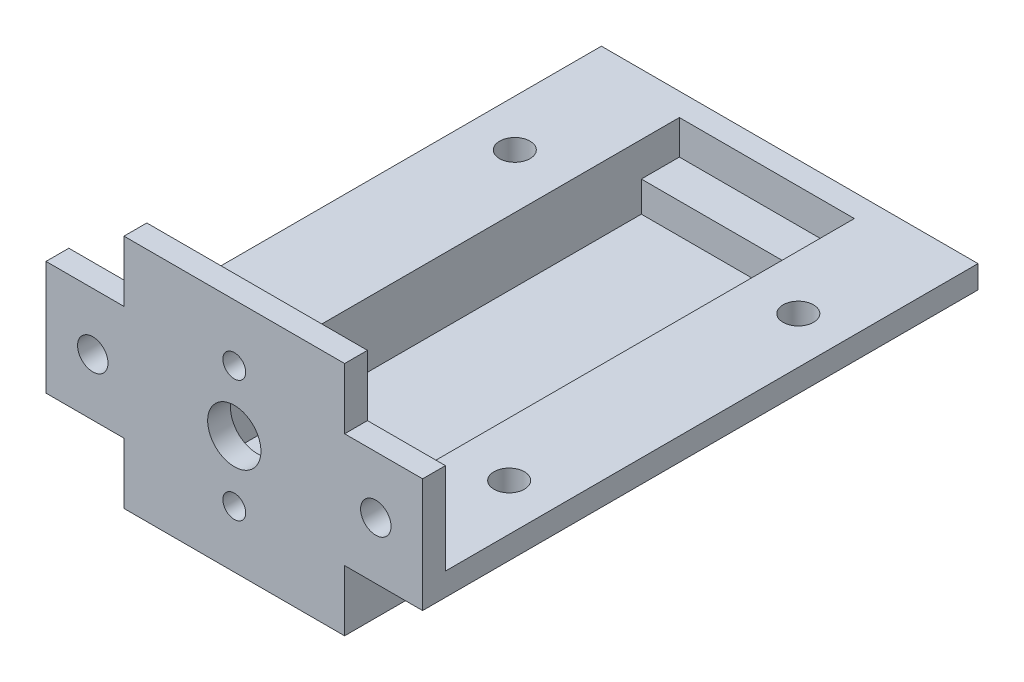
from build123d import *

# Parameters (mm, degrees)
SALIENTE_EXTRUIR2_DEPTH = 3
SALIENTE_EXTRUIR3_DEPTH = 70
CROQUIS_HUECO_MOTOR_W   = 23
CROQUIS_HUECO_MOTOR_H   = 67
HUECO_MOTOR_DEPTH       = 8.5
CROQUIS10_R             = 3.5
CROQUIS10_R_2           = 2
CROQUIS10_R_3           = 1.5
TORNILLO_Y_MOTOR_DEPTH  = 5
CROQUIS12_W             = 23
CROQUIS12_H             = 5
SALIENTE_EXTRUIR5_DEPTH = 4
CROQUIS16_R             = 2
CORTAR_EXTRUIR4_DEPTH   = 77.893188905


with BuildPart() as part:
    # Croquis4 → Saliente-Extruir2 (new body)
    with BuildSketch(Plane.XY):
        Polygon((14.5, 16), (-14.5, 16), (-14.5, 8), (-24.75, 8), (-24.75, -7), (-14.5, -7), (-14.5, -15), (14.5, -15), (14.5, -7), (24.75, -7), (24.75, 8), (14.5, 8), align=None)
    extrude(amount=SALIENTE_EXTRUIR2_DEPTH)

    # Croquis5 → Saliente-Extruir3 (add)
    with BuildSketch(Plane(origin=(0, 0, 0), x_dir=(-1, 0, 0), z_dir=(0, 0, -1))):
        Polygon((-24.75, -4), (-24.75, -7), (-14.5, -7), (-14.5, -15), (14.5, -15), (14.5, -7), (24.75, -7), (24.75, -4), align=None)
    extrude(amount=SALIENTE_EXTRUIR3_DEPTH)

    # croquis hueco motor → hueco motor (cut)
    with BuildSketch(Plane(origin=(0, -4, 0), x_dir=(1, 0, 0), z_dir=(0, 1, 0))):
        with Locations((0, 33.5)):
            Rectangle(CROQUIS_HUECO_MOTOR_W, CROQUIS_HUECO_MOTOR_H)
    extrude(amount=-HUECO_MOTOR_DEPTH, mode=Mode.SUBTRACT)

    # Croquis10 → tornillo y motor (cut)
    with BuildSketch(Plane.XY.offset(3)):
        with Locations((0, 0.5)):
            Circle(CROQUIS10_R)
        with Locations((-18.6, 0.5)):
            Circle(CROQUIS10_R_2)
        with Locations(Location((18.6, 0.5, 0), (0, 0, 180))):
            Circle(CROQUIS10_R_2)
        with Locations((0, 8.5)):
            Circle(CROQUIS10_R_3)
        with Locations(Location((0, -7.5, 0), (0, 0, 180))):
            Circle(CROQUIS10_R_3)
    extrude(amount=-TORNILLO_Y_MOTOR_DEPTH, mode=Mode.SUBTRACT)

    # Croquis12 → Saliente-Extruir5 (add)
    with BuildSketch(Plane(origin=(0, -12.5, 0), x_dir=(1, 0, 0), z_dir=(0, 1, 0))):
        with Locations((0, 64.5)):
            Rectangle(CROQUIS12_W, CROQUIS12_H)
    extrude(amount=SALIENTE_EXTRUIR5_DEPTH)

    # Croquis16 → Cortar-Extruir4 (cut, through all)
    with BuildSketch(Plane(origin=(0, -4, 0), x_dir=(1, 0, 0), z_dir=(0, 1, 0))):
        with Locations(Location((-18.63, 52.5, 0), (0, 0, 180))):
            Circle(CROQUIS16_R)
        with Locations(Location((-18.63, 14.5, 0), (0, 0, 270))):
            Circle(CROQUIS16_R)
        with Locations(Location((18.63, 14.5, 0), (0, 0, 180))):
            Circle(CROQUIS16_R)
        with Locations(Location((18.63, 52.5, 0), (0, 0, 180))):
            Circle(CROQUIS16_R)
    extrude(amount=-CORTAR_EXTRUIR4_DEPTH, mode=Mode.SUBTRACT)


solid = part.part
